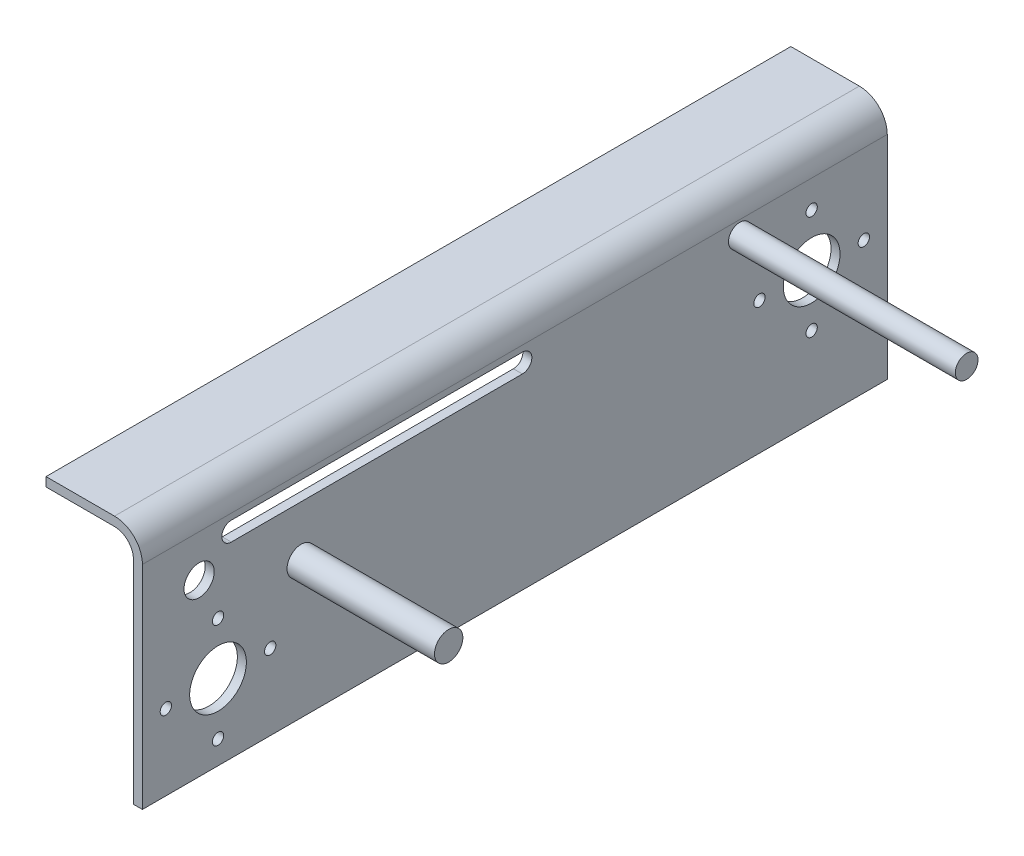
from build123d import *

# Parameters (mm, degrees)
SALIENTE_EXTRUIR1_DEPTH = 394
CROQUIS2_R              = 3
CROQUIS2_R_2            = 15
CORTAR_EXTRUIR1_DEPTH   = 425.673777624
CROQUIS4_R              = 8
CORTAR_EXTRUIR3_DEPTH   = 426.218662567
CROQUIS5_R              = 7.5
SALIENTE_EXTRUIR2_DEPTH = 78
CROQUIS6_R              = 6
SALIENTE_EXTRUIR3_DEPTH = 120
CORTAR_EXTRUIR4_DEPTH   = 439.873456699


with BuildPart() as part:
    # Croquis1 → Saliente-Extruir1 (new body)
    with BuildSketch(Plane.XY):
        with BuildLine():
            Line((96.164660939, 24.571471574), (100.927160939, 24.571471574))
            Line((100.927160939, 24.571471574), (100.927160939, 136.808971574))
            ThreePointArc((100.927160939, 136.808971574), (96.603324796, 147.247635431), (86.164660939, 151.571471574))
            Line((86.164660939, 151.571471574), (49.927160939, 151.571471574))
            Line((49.927160939, 151.571471574), (49.927160939, 146.808971574))
            Line((49.927160939, 146.808971574), (86.164660939, 146.808971574))
            ThreePointArc((86.164660939, 146.808971574), (93.235728751, 143.880039386), (96.164660939, 136.808971574))
            Line((96.164660939, 136.808971574), (96.164660939, 24.571471574))
        make_face()
    extrude(amount=-SALIENTE_EXTRUIR1_DEPTH)

    # Croquis2 → Cortar-Extruir1 (cut, through all)
    with BuildSketch(Plane.ZY.offset(-96.164660939)):
        with Locations(Location((-40, 36.973884985, 0), (0, 0, 180))):
            Circle(CROQUIS2_R)
        with Locations(Location((-12.402413411, 64.571471574, 0), (0, 0, 180))):
            Circle(CROQUIS2_R)
        with Locations(Location((-67.597586589, 64.571471574, 0), (0, 0, 180))):
            Circle(CROQUIS2_R)
        with Locations(Location((-40, 92.169058163, 0), (0, 0, 180))):
            Circle(CROQUIS2_R)
        with Locations(Location((-40, 64.571471574, 0), (0, 0, 180))):
            Circle(CROQUIS2_R_2)
        with Locations(Location((-326.402413411, 94.571471574, 0), (0, 0, 180))):
            Circle(CROQUIS2_R)
        with Locations(Location((-354, 66.973884985, 0), (0, 0, 180))):
            Circle(CROQUIS2_R)
        with Locations(Location((-354, 94.571471574, 0), (0, 0, 180))):
            Circle(CROQUIS2_R_2)
        with Locations(Location((-381.597586589, 94.571471574, 0), (0, 0, 180))):
            Circle(CROQUIS2_R)
        with Locations(Location((-354, 122.169058163, 0), (0, 0, 180))):
            Circle(CROQUIS2_R)
    extrude(amount=-CORTAR_EXTRUIR1_DEPTH, mode=Mode.SUBTRACT)

    # Croquis4 → Cortar-Extruir3 (cut, through all)
    with BuildSketch(Plane(origin=(100.927160939, 0, 0), x_dir=(0, 0, -1), z_dir=(1, 0, 0))):
        with Locations(Location((30, 114.571471574, 0), (0, 0, 90))):
            Circle(CROQUIS4_R)
    extrude(amount=-CORTAR_EXTRUIR3_DEPTH, mode=Mode.SUBTRACT)

    # Croquis5 → Saliente-Extruir2 (add)
    with BuildSketch(Plane(origin=(100.927160939, 0, 0), x_dir=(0, 0, -1), z_dir=(1, 0, 0))):
        with Locations(Location((84, 96.571471574, 0), (0, 0, 90))):
            Circle(CROQUIS5_R)
    extrude(amount=SALIENTE_EXTRUIR2_DEPTH)

    # Croquis6 → Saliente-Extruir3 (add)
    with BuildSketch(Plane(origin=(100.927160939, 0, 0), x_dir=(0, 0, -1), z_dir=(1, 0, 0))):
        with Locations(Location((316, 129.571471574, 0), (0, 0, 90))):
            Circle(CROQUIS6_R)
    extrude(amount=SALIENTE_EXTRUIR3_DEPTH)

    # Croquis7 → Cortar-Extruir4 (cut, through all)
    with BuildSketch(Plane(origin=(100.927160939, 0, 0), x_dir=(0, 0, -1), z_dir=(1, 0, 0))):
        with BuildLine():
            Line((47, 133.571471574), (201, 133.571471574))
            ThreePointArc((201, 133.571471574), (206, 128.571471574), (201, 123.571471574))
            Line((201, 123.571471574), (47, 123.571471574))
            ThreePointArc((47, 123.571471574), (42, 128.571471574), (47, 133.571471574))
        make_face()
    extrude(amount=-CORTAR_EXTRUIR4_DEPTH, mode=Mode.SUBTRACT)


solid = part.part
